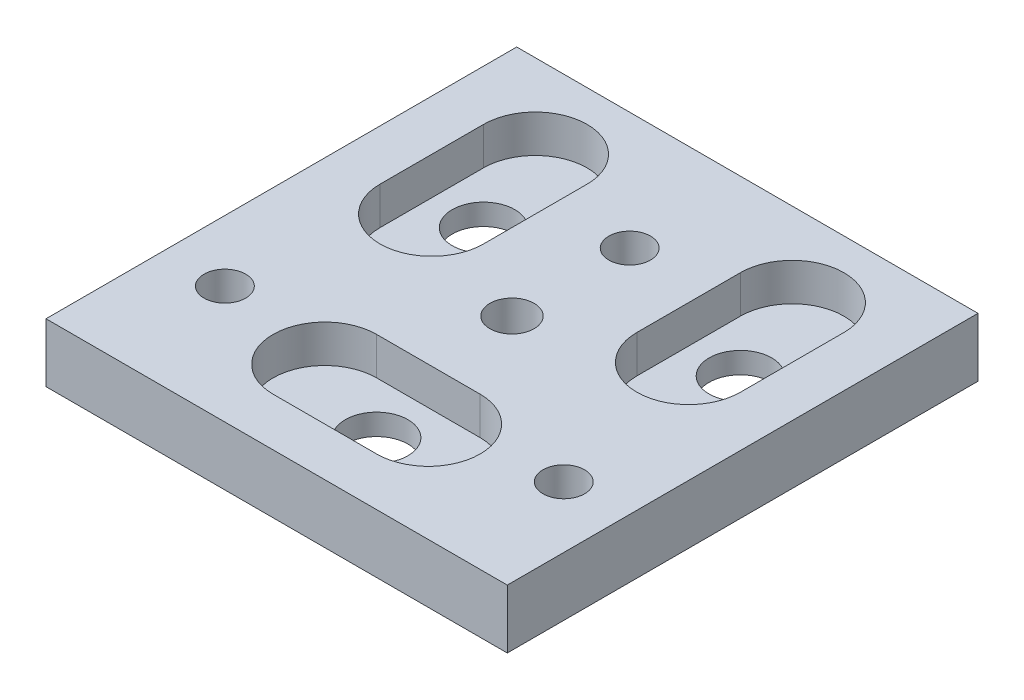
from build123d import *

# Parameters (mm, degrees)
SKETCH1_W               = 49.784
SKETCH1_H               = 50.8
BOSS_EXTRUDE1_DEPTH     = 6.35
F_8_CLEARANCE_HOLE1_D   = 4.4958
F_1_4_CLEARANCE_HOLE1_D = 6.7564
CUT_EXTRUDE1_DEPTH      = 4.064
SKETCH9_R               = 2.38125
CUT_EXTRUDE2_DEPTH      = 37.126087029
BODY_MOVE_COPY1_ANGLE   = 180


with BuildPart() as part:
    # Sketch1 → Boss-Extrude1 (new body)
    with BuildSketch(Plane(origin=(0, 0, 0), x_dir=(1, 0, 0), z_dir=(0, 1, 0))):
        Rectangle(SKETCH1_W, SKETCH1_H)
    extrude(amount=BOSS_EXTRUDE1_DEPTH)

    # #8 Clearance Hole1 (through all)
    with Locations(Plane(origin=(0, 6.35, 0), x_dir=(1, 0, 0), z_dir=(0, 1, 0))):
        with Locations((-18.288, 12.7), (18.288, 12.7), (0, -12.7)):
            Hole(F_8_CLEARANCE_HOLE1_D / 2)

    # 1/4 Clearance Hole1 (through all)
    with Locations(Plane(origin=(0, 6.35, 0), x_dir=(1, 0, 0), z_dir=(0, 1, 0))):
        with Locations((0, 14.61008), (-13.86078, -10.78992), (13.86078, -10.78992)):
            Hole(F_1_4_CLEARANCE_HOLE1_D / 2)

    # Sketch8 → Cut-Extrude1 (cut)
    with BuildSketch(Plane.XZ):
        with BuildLine():
            Line((-19.44878, 16.37792), (-19.44878, 5.20192))
            ThreePointArc((-19.44878, 5.20192), (-13.86078, -0.38608), (-8.27278, 5.20192))
            Line((-8.27278, 5.20192), (-8.27278, 16.37792))
            ThreePointArc((-8.27278, 16.37792), (-13.86078, 21.96592), (-19.44878, 16.37792))
        make_face()
        with BuildLine():
            Line((8.27278, 16.37792), (8.27278, 5.20192))
            ThreePointArc((8.27278, 5.20192), (13.86078, -0.38608), (19.44878, 5.20192))
            Line((19.44878, 5.20192), (19.44878, 16.37792))
            ThreePointArc((19.44878, 16.37792), (13.86078, 21.96592), (8.27278, 16.37792))
        make_face()
        with BuildLine():
            Line((-5.588, -9.02208), (5.588, -9.02208))
            ThreePointArc((5.588, -9.02208), (11.176, -14.61008), (5.588, -20.19808))
            Line((5.588, -20.19808), (-5.588, -20.19808))
            ThreePointArc((-5.588, -20.19808), (-11.176, -14.61008), (-5.588, -9.02208))
        make_face()
    extrude(amount=-CUT_EXTRUDE1_DEPTH, mode=Mode.SUBTRACT)

    # Sketch9 → Cut-Extrude2 (cut, through all)
    with BuildSketch(Plane(origin=(0, 6.35, 0), x_dir=(1, 0, 0), z_dir=(0, 1, 0))):
        with Locations(Location((0, 0, 0), (0, 0, 270))):
            Circle(SKETCH9_R)
    extrude(amount=-CUT_EXTRUDE2_DEPTH, mode=Mode.SUBTRACT)


with BuildPart() as part_1:
    # Body-Move/Copy1: moved
    add(part.part.rotate(Axis((0, 3.175, 0), (1, 0, 0)), BODY_MOVE_COPY1_ANGLE))


solid = part_1.part
